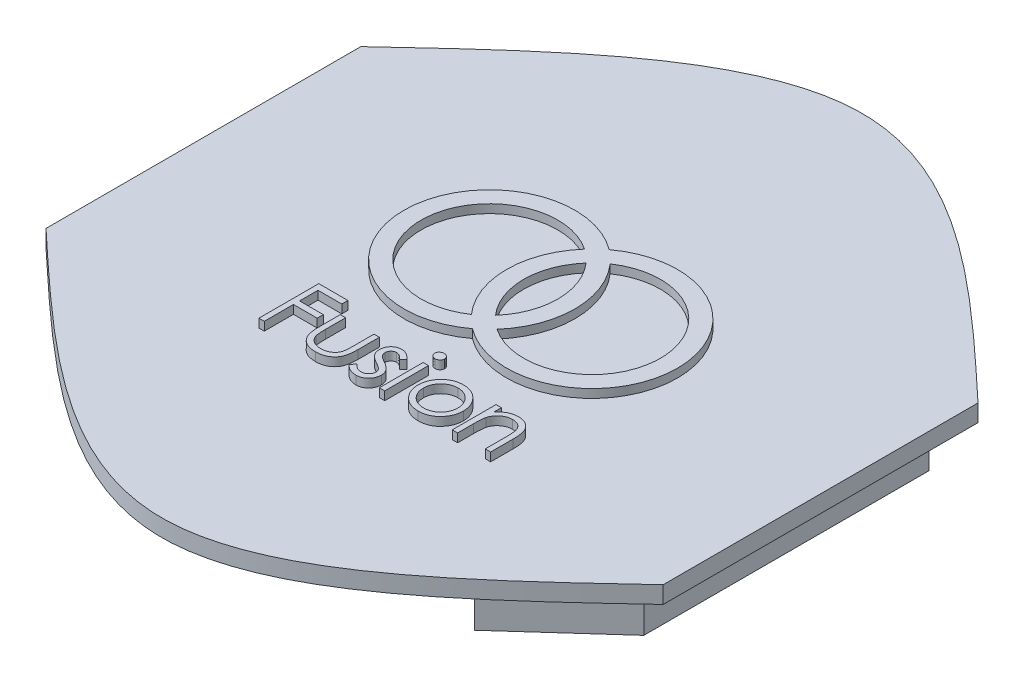
from build123d import *

# Parameters (mm, degrees)
BOSS_EXTRUDE1_DEPTH = 1
BOSS_EXTRUDE2_DEPTH = 3
BOSS_EXTRUDE3_DEPTH = 0.5
SKETCH6_W           = 0.314102564
SKETCH6_H           = 2.557692308
BOSS_EXTRUDE4_DEPTH = 0.5


with BuildPart() as part:
    # Sketch1 → Boss-Extrude1 (new body)
    with BuildSketch(Plane(origin=(0, 0, 0), x_dir=(1, 0, 0), z_dir=(0, 1, 0))):
        with BuildLine():
            Line((0, 41.863275017), (0, 60.273275017))
            add(Edge.make_bspline(
                [(-36.089994589, 60.273275017), (-30.074992276, 65.911788101), (-18.044987203, 77.188479216), (-6.014995884, 65.911788385), (0, 60.273275017)],
                knots=[0, 0, 0, 0, 0.499999981, 1, 1, 1, 1], degree=3))
            Line((-36.089994589, 60.273275017), (-36.089994589, 41.863275017))
            add(Edge.make_bspline(
                [(-36.089994589, 41.863275017), (-30.074992276, 36.224761933), (-18.044987203, 24.948070818), (-6.014995884, 36.22476165), (0, 41.863275017)],
                knots=[0, 0, 0, 0, 0.499999981, 1, 1, 1, 1], degree=3))
        make_face()
    extrude(amount=BOSS_EXTRUDE1_DEPTH)

    # Sketch3 → Boss-Extrude2 (add)
    with BuildSketch(Plane.XZ):
        Polygon((-28.881902587, -64.094380048), (-34.089994589, -59.406509446), (-34.089994589, -42.730040589), (-28.881860862, -38.042159643), (-27.59860355, -39.5761905), (-32.210609347, -43.414080875), (-32.210609347, -58.722469159), (-27.5986156, -62.560374014), align=None)
        Polygon((-7.208092002, -64.094380048), (-8.491378989, -62.560374014), (-3.879385242, -58.722469159), (-3.879385242, -43.414080875), (-8.491391038, -39.5761905), (-7.208133727, -38.042159643), (-2, -42.730040589), (-2, -59.406509446), align=None)
    extrude(amount=BOSS_EXTRUDE2_DEPTH)

    # Sketch5 → Boss-Extrude3 (add)
    with BuildSketch(Plane(origin=(0, 1, 0), x_dir=(1, 0, 0), z_dir=(0, 1, 0))):
        with BuildLine():
            ThreePointArc((-18.044997294, 56.751086287), (-26.044997294, 52.751086287), (-18.044997294, 48.751086287))
            ThreePointArc((-18.044997294, 48.751086287), (-10.044997294, 52.751086287), (-18.044997294, 56.751086287))
        make_face()
        with BuildLine():
            ThreePointArc((-18.044997294, 55.396837598), (-17.044997294, 52.751086287), (-18.044997294, 50.105334976))
            ThreePointArc((-18.044997294, 50.105334976), (-19.044997294, 52.751086287), (-18.044997294, 55.396837598))
        make_face(mode=Mode.SUBTRACT)
        with BuildLine():
            ThreePointArc((-17.294997294, 56.058275426), (-11.044997294, 52.751086287), (-17.294997294, 49.443897149))
            ThreePointArc((-17.294997294, 49.443897149), (-16.044997294, 52.751086287), (-17.294997294, 56.058275426))
        make_face(mode=Mode.SUBTRACT)
        with BuildLine():
            ThreePointArc((-18.794997294, 56.058275426), (-20.044997294, 52.751086287), (-18.794997294, 49.443897149))
            ThreePointArc((-18.794997294, 49.443897149), (-25.044997294, 52.751086287), (-18.794997294, 56.058275426))
        make_face(mode=Mode.SUBTRACT)
    extrude(amount=BOSS_EXTRUDE3_DEPTH)

    # Sketch6 → Boss-Extrude4 (add)
    # profile 1 of 7: a face of its own
    with BuildSketch(Plane(origin=(0, 1, 0), x_dir=(1, 0, 0), z_dir=(0, 1, 0))):
        Polygon((-24.817053319, 46.540134371), (-23.111925113, 46.540134371), (-23.111925113, 46.181160012), (-24.502950754, 46.181160012), (-24.502950754, 45.104236935), (-23.111925113, 45.104236935), (-23.111925113, 44.745262576), (-24.502950754, 44.745262576), (-24.502950754, 43.040134371), (-24.817053319, 43.040134371), align=None)
    # profile 2 of 7: a face of its own
    with BuildSketch(Plane(origin=(0, 1, 0), x_dir=(1, 0, 0), z_dir=(0, 1, 0))):
        with BuildLine():
            Line((-22.61833537, 45.597826679), (-22.304232806, 45.597826679))
            Line((-22.304232806, 45.597826679), (-22.304232806, 44.411528602))
            add(Edge.make_bspline(
                [(-22.304232806, 44.411528602), (-22.304090901, 44.376705853), (-22.303819443, 44.310091565), (-22.301978502, 44.214236378), (-22.297648409, 44.126819665), (-22.292234584, 44.047790928), (-22.285272448, 43.977163537), (-22.276989088, 43.91518418), (-22.267730666, 43.861149996), (-22.258667952, 43.82860664), (-22.254453158, 43.813471711)],
                knots=[0, 0, 0, 0, 1.388932606, 2.656963016, 3.823490214, 4.879454478, 5.816252168, 6.653371382, 7.373723809, 8, 8, 8, 8], degree=3))
            add(Edge.make_bspline(
                [(-22.254453158, 43.813471711), (-22.247691703, 43.79444884), (-22.234309362, 43.756798579), (-22.210035878, 43.702409574), (-22.180007542, 43.652034291), (-22.147147714, 43.603730218), (-22.109248306, 43.558928232), (-22.066788835, 43.517703988), (-22.021190598, 43.478499897), (-21.953435575, 43.432115105), (-21.860776309, 43.382399775), (-21.739123554, 43.339503956), (-21.607219328, 43.313868136), (-21.516054608, 43.310893881), (-21.469196748, 43.30936514)],
                knots=[0, 0, 0, 0, 0.725840625, 1.436591201, 2.137033971, 2.831655856, 3.53531722, 4.242432219, 4.957935707, 5.694543706, 7.190802206, 8.724350549, 10.316345118, 12, 12, 12, 12], degree=3))
            add(Edge.make_bspline(
                [(-21.469196748, 43.30936514), (-21.42234324, 43.310926389), (-21.331690372, 43.313947116), (-21.201235403, 43.338730655), (-21.081983988, 43.380136344), (-20.975133037, 43.437943755), (-20.881167197, 43.508685818), (-20.802862778, 43.591694627), (-20.738255523, 43.684344014), (-20.710046103, 43.753468293), (-20.695859408, 43.788231326)],
                knots=[0, 0, 0, 0, 1.157059328, 2.238695713, 3.266970494, 4.264342957, 5.228770407, 6.160125903, 7.074715775, 8, 8, 8, 8], degree=3))
            add(Edge.make_bspline(
                [(-20.695859408, 43.788231326), (-20.691665178, 43.802197625), (-20.68239276, 43.8330737), (-20.672430408, 43.885453449), (-20.663455947, 43.947918053), (-20.655792771, 44.020876262), (-20.650327608, 44.104137414), (-20.647381581, 44.19767549), (-20.644053306, 44.301196851), (-20.64400279, 44.37366461), (-20.643976395, 44.411528602)],
                knots=[0, 0, 0, 0, 0.557542046, 1.232589297, 2.036731608, 2.971723315, 4.038036528, 5.22795436, 6.551621927, 8, 8, 8, 8], degree=3))
            Line((-20.643976395, 44.411528602), (-20.643976395, 45.597826679))
            Line((-20.643976395, 45.597826679), (-20.329873831, 45.597826679))
            Line((-20.329873831, 45.597826679), (-20.329873831, 44.352634371))
            add(Edge.make_bspline(
                [(-20.329873831, 44.352634371), (-20.330315526, 44.3103272), (-20.331172475, 44.2282455), (-20.336679818, 44.108961388), (-20.346129431, 43.997799143), (-20.360472116, 43.894699923), (-20.37733779, 43.799742442), (-20.399094063, 43.712804996), (-20.425072301, 43.634155442), (-20.454377816, 43.562413665), (-20.488999683, 43.497366771), (-20.525826704, 43.435630954), (-20.568351476, 43.378738019), (-20.61312171, 43.323855882), (-20.662923366, 43.273714354), (-20.716823225, 43.227162878), (-20.774062645, 43.183489847), (-20.835911843, 43.144398567), (-20.901467906, 43.109181922), (-20.970811763, 43.077965844), (-21.044792761, 43.053263267), (-21.122456398, 43.031952601), (-21.204183177, 43.015238132), (-21.28989431, 43.003451565), (-21.379560927, 42.996226234), (-21.440670386, 42.995589189), (-21.472001235, 42.995262576)],
                knots=[0, 0, 0, 0, 1.493040784, 2.896703357, 4.213163133, 5.428574705, 6.569057535, 7.615249723, 8.588095153, 9.490268104, 10.346124644, 11.18633936, 12.024365274, 12.850166724, 13.684164916, 14.514361689, 15.362232829, 16.222528818, 17.093394965, 17.986930858, 18.902426812, 19.842810585, 20.827885679, 21.843828298, 22.894529745, 24, 24, 24, 24], degree=3))
            add(Edge.make_bspline(
                [(-21.472001235, 42.995262576), (-21.503097749, 42.995602283), (-21.564205294, 42.99626984), (-21.653876539, 43.003411647), (-21.739825145, 43.015219818), (-21.821745543, 43.032075035), (-21.899719941, 43.053114105), (-21.974064181, 43.078117641), (-22.043907744, 43.109198122), (-22.110089748, 43.14417568), (-22.172092136, 43.183740955), (-22.230200714, 43.227108995), (-22.284337566, 43.274215058), (-22.334514634, 43.324862415), (-22.380027611, 43.379679351), (-22.421443653, 43.438224912), (-22.459400358, 43.499919), (-22.493753148, 43.565982163), (-22.523264904, 43.638554173), (-22.54932015, 43.71885127), (-22.570630788, 43.807753787), (-22.587973256, 43.905185715), (-22.601924697, 44.010680757), (-22.611610839, 44.124849172), (-22.61702667, 44.247412864), (-22.617889731, 44.332062754), (-22.61833537, 44.37577139)],
                knots=[0, 0, 0, 0, 1.083640291, 2.129454052, 3.13281866, 4.105697902, 5.042300162, 5.946461698, 6.836384745, 7.703652036, 8.553297018, 9.397182691, 10.228592656, 11.052265423, 11.879314572, 12.708807002, 13.549817954, 14.402308542, 15.300838682, 16.27712199, 17.341985831, 18.484375296, 19.725102775, 21.0496083, 22.476576903, 24, 24, 24, 24], degree=3))
            Line((-22.61833537, 44.37577139), (-22.61833537, 45.597826679))
        make_face()
    # profile 3 of 7: a face of its own
    with BuildSketch(Plane(origin=(0, 1, 0), x_dir=(1, 0, 0), z_dir=(0, 1, 0))):
        with BuildLine():
            Line((-18.400386652, 45.278816262), (-18.613527677, 45.05936514))
            add(Edge.make_bspline(
                [(-18.613527677, 45.05936514), (-18.631918181, 45.080678287), (-18.667372907, 45.121767524), (-18.723604388, 45.17670459), (-18.779627991, 45.222841529), (-18.834676805, 45.261793788), (-18.890135074, 45.291242935), (-18.945351992, 45.312737797), (-19.000384731, 45.326039602), (-19.037170766, 45.327754041), (-19.055234408, 45.32859591)],
                knots=[0, 0, 0, 0, 1.26578478, 2.440284043, 3.530471711, 4.527705817, 5.468200915, 6.346673037, 7.188140097, 8, 8, 8, 8], degree=3))
            add(Edge.make_bspline(
                [(-19.055234408, 45.32859591), (-19.077373798, 45.327521037), (-19.120940984, 45.325405839), (-19.183366802, 45.304292408), (-19.241317427, 45.27188367), (-19.291474407, 45.225915086), (-19.333962087, 45.173150817), (-19.364975768, 45.114154493), (-19.383941752, 45.050706449), (-19.386346484, 45.006676591), (-19.387566139, 44.984345108)],
                knots=[0, 0, 0, 0, 0.99966794, 1.967205029, 2.953328237, 3.988086729, 5.028030931, 6.008226631, 6.989793394, 8, 8, 8, 8], degree=3))
            add(Edge.make_bspline(
                [(-19.387566139, 44.984345108), (-19.386455327, 44.964133064), (-19.384236834, 44.923765953), (-19.366990154, 44.864217919), (-19.339524082, 44.806160881), (-19.313853888, 44.770597975), (-19.300627036, 44.752273794)],
                knots=[0, 0, 0, 0, 0.960159726, 1.917612774, 2.927026955, 4, 4, 4, 4], degree=3))
            add(Edge.make_bspline(
                [(-19.300627036, 44.752273794), (-19.292663543, 44.74248921), (-19.27571425, 44.721663955), (-19.243905735, 44.692760102), (-19.207883232, 44.660817851), (-19.164563294, 44.628881014), (-19.115812266, 44.595249289), (-19.060572982, 44.561247156), (-19.000598477, 44.524282731), (-18.957661171, 44.500838295), (-18.935342581, 44.488651999)],
                knots=[0, 0, 0, 0, 0.66740084, 1.420478572, 2.27185888, 3.217733974, 4.268547843, 5.408967954, 6.65319498, 8, 8, 8, 8], degree=3))
            add(Edge.make_bspline(
                [(-18.935342581, 44.488651999), (-18.908129004, 44.473407096), (-18.855561334, 44.443958964), (-18.780868567, 44.398249261), (-18.713081526, 44.352817836), (-18.651625858, 44.308150562), (-18.597684049, 44.262997695), (-18.549619497, 44.219089938), (-18.508631053, 44.17510063), (-18.485677126, 44.144367516), (-18.474705562, 44.12967764)],
                knots=[0, 0, 0, 0, 1.27191281, 2.456916733, 3.569705269, 4.599008579, 5.553216877, 6.436649441, 7.252746552, 8, 8, 8, 8], degree=3))
            add(Edge.make_bspline(
                [(-18.474705562, 44.12967764), (-18.456495035, 44.100011552), (-18.420252705, 44.040970531), (-18.382194439, 43.943752104), (-18.360134164, 43.840641601), (-18.357071944, 43.770109381), (-18.355514857, 43.734244948)],
                knots=[0, 0, 0, 0, 0.995354457, 1.980940102, 2.973342415, 4, 4, 4, 4], degree=3))
            add(Edge.make_bspline(
                [(-18.355514857, 43.734244948), (-18.356234391, 43.708975802), (-18.357652311, 43.659180189), (-18.367510378, 43.585845359), (-18.384465354, 43.515710801), (-18.407559108, 43.448015517), (-18.438743481, 43.384056577), (-18.475291278, 43.322220328), (-18.51916619, 43.263844397), (-18.569257565, 43.209005437), (-18.624103059, 43.15891969), (-18.682609198, 43.114895736), (-18.744848028, 43.078321399), (-18.81037483, 43.048056053), (-18.879338484, 43.023987795), (-18.951749773, 43.007325264), (-19.027378528, 42.997352503), (-19.078808336, 42.995968027), (-19.105014056, 42.995262576)],
                knots=[0, 0, 0, 0, 1.032770009, 2.035186124, 3.017557409, 3.978232242, 4.952395191, 5.920591857, 6.910227898, 7.931268572, 8.952309245, 9.941945286, 10.918353717, 11.897095711, 12.887975737, 13.898235213, 14.929059601, 16, 16, 16, 16], degree=3))
            add(Edge.make_bspline(
                [(-19.105014056, 42.995262576), (-19.140381231, 42.996255277), (-19.210624158, 42.998226884), (-19.314513877, 43.016732945), (-19.416034636, 43.045528339), (-19.514418176, 43.085244273), (-19.60746429, 43.135394986), (-19.692595215, 43.195457379), (-19.770106677, 43.263447377), (-19.814224951, 43.315560288), (-19.836284088, 43.341616743)],
                knots=[0, 0, 0, 0, 1.013940152, 2.01379169, 3.017749504, 4.037548394, 5.051665909, 6.043208538, 7.021604269, 8, 8, 8, 8], degree=3))
            Line((-19.836284088, 43.341616743), (-19.628050915, 43.57859591))
            add(Edge.make_bspline(
                [(-19.628050915, 43.57859591), (-19.608278502, 43.557241145), (-19.569946689, 43.515841705), (-19.508645473, 43.460717364), (-19.446266072, 43.414516093), (-19.383431385, 43.375872678), (-19.319211291, 43.346097275), (-19.253965676, 43.325178681), (-19.187827252, 43.311734489), (-19.143405117, 43.310156207), (-19.121139857, 43.30936514)],
                knots=[0, 0, 0, 0, 1.179806542, 2.287233372, 3.337373186, 4.324005949, 5.273901747, 6.200048787, 7.097828587, 8, 8, 8, 8], degree=3))
            add(Edge.make_bspline(
                [(-19.121139857, 43.30936514), (-19.090821931, 43.310735965), (-19.031585789, 43.313414327), (-18.946742031, 43.337731419), (-18.868403404, 43.375861371), (-18.800380059, 43.429946069), (-18.742477898, 43.492901642), (-18.700549723, 43.563815761), (-18.674273548, 43.640607218), (-18.671187549, 43.69383952), (-18.669617421, 43.720923634)],
                knots=[0, 0, 0, 0, 1.072336372, 2.095165389, 3.102688358, 4.141489647, 5.156069229, 6.117746104, 7.042326257, 8, 8, 8, 8], degree=3))
            add(Edge.make_bspline(
                [(-18.669617421, 43.720923634), (-18.670703715, 43.743233253), (-18.672848458, 43.787280608), (-18.68969173, 43.851030949), (-18.716304582, 43.91150023), (-18.742509231, 43.946889877), (-18.755855402, 43.964914019)],
                knots=[0, 0, 0, 0, 1.013901739, 2.00181326, 2.98231254, 4, 4, 4, 4], degree=3))
            add(Edge.make_bspline(
                [(-18.755855402, 43.964914019), (-18.763877796, 43.973949381), (-18.781353469, 43.993631663), (-18.81340871, 44.022056742), (-18.851790572, 44.052694841), (-18.896930735, 44.08502643), (-18.948920197, 44.118625035), (-19.007969672, 44.153314387), (-19.073270225, 44.190742113), (-19.119440856, 44.215561768), (-19.143575754, 44.228535813)],
                knots=[0, 0, 0, 0, 0.615000592, 1.339693406, 2.178160186, 3.116406724, 4.166410947, 5.330106347, 6.604359322, 8, 8, 8, 8], degree=3))
            add(Edge.make_bspline(
                [(-19.143575754, 44.228535813), (-19.169622394, 44.243074945), (-19.220135142, 44.271270961), (-19.291682433, 44.315187042), (-19.356229787, 44.359854316), (-19.415330362, 44.402767156), (-19.467491367, 44.446188099), (-19.512507316, 44.490165351), (-19.552150531, 44.532925337), (-19.574097943, 44.563222634), (-19.584581363, 44.577694467)],
                knots=[0, 0, 0, 0, 1.262093308, 2.447601706, 3.550203992, 4.582594899, 5.537233252, 6.418365656, 7.244515135, 8, 8, 8, 8], degree=3))
            add(Edge.make_bspline(
                [(-19.584581363, 44.577694467), (-19.602711963, 44.606840082), (-19.638979498, 44.665141498), (-19.674194689, 44.762451974), (-19.698400718, 44.864897032), (-19.700563108, 44.935583886), (-19.701668703, 44.971724916)],
                knots=[0, 0, 0, 0, 0.985009483, 1.970363186, 2.962279964, 4, 4, 4, 4], degree=3))
            add(Edge.make_bspline(
                [(-19.701668703, 44.971724916), (-19.701134508, 44.995350314), (-19.700089012, 45.041588565), (-19.69174496, 45.109527385), (-19.676553249, 45.174075539), (-19.657498326, 45.236202402), (-19.631015322, 45.294704496), (-19.599369417, 45.350361967), (-19.562181992, 45.403097885), (-19.519338701, 45.452101017), (-19.472232056, 45.496610343), (-19.421337286, 45.535408971), (-19.36779903, 45.568515326), (-19.31139061, 45.596280487), (-19.251570137, 45.617281869), (-19.188755751, 45.631739255), (-19.123074596, 45.641394457), (-19.07817347, 45.642257542), (-19.055234408, 45.642698474)],
                knots=[0, 0, 0, 0, 1.087655834, 2.128696564, 3.144119009, 4.137814668, 5.115653402, 6.093965665, 7.082169637, 8.081268856, 9.086088321, 10.061021666, 11.022561449, 11.980240094, 12.950172527, 13.934149372, 14.944599409, 16, 16, 16, 16], degree=3))
            add(Edge.make_bspline(
                [(-19.055234408, 45.642698474), (-19.028042345, 45.641594133), (-18.973148123, 45.639364735), (-18.890793497, 45.621659045), (-18.808560155, 45.592525941), (-18.726236805, 45.552289707), (-18.644426515, 45.500222831), (-18.562409659, 45.437293532), (-18.479201629, 45.363915817), (-18.427245315, 45.307816592), (-18.400386652, 45.278816262)],
                knots=[0, 0, 0, 0, 0.845714091, 1.707292901, 2.609013841, 3.555613372, 4.552488639, 5.621697636, 6.770543573, 8, 8, 8, 8], degree=3))
        make_face()
    # profile 4 of 7: a face of its own
    with BuildSketch(Plane(origin=(0, 1, 0), x_dir=(1, 0, 0), z_dir=(0, 1, 0))):
        with BuildLine():
            add(Edge.make_bspline(
                [(-17.616532485, 46.674749756), (-17.597041169, 46.673845603), (-17.55887343, 46.672075099), (-17.503680162, 46.656913622), (-17.45342315, 46.631213937), (-17.408845417, 46.596734256), (-17.37059353, 46.556184812), (-17.34381282, 46.508923844), (-17.326600424, 46.457865205), (-17.324521868, 46.422250116), (-17.323463575, 46.404116743)],
                knots=[0, 0, 0, 0, 1.055194115, 2.066272739, 3.074728998, 4.095836921, 5.109056067, 6.073838105, 7.019297344, 8, 8, 8, 8], degree=3))
            add(Edge.make_bspline(
                [(-17.323463575, 46.404116743), (-17.324545735, 46.38645409), (-17.326685037, 46.351537115), (-17.343799525, 46.301363643), (-17.370821763, 46.254759359), (-17.408820888, 46.214288649), (-17.453429649, 46.179828029), (-17.503678435, 46.15412329), (-17.558873884, 46.138963153), (-17.597041323, 46.137192464), (-17.616532485, 46.136288217)],
                knots=[0, 0, 0, 0, 0.96129708, 1.900370562, 2.859976407, 3.87933698, 4.906634145, 5.921202961, 6.938410037, 8, 8, 8, 8], degree=3))
            add(Edge.make_bspline(
                [(-17.616532485, 46.136288217), (-17.63580076, 46.137157937), (-17.67330394, 46.138850734), (-17.727670783, 46.154420752), (-17.777499272, 46.179836825), (-17.822163945, 46.21406301), (-17.859394138, 46.255007907), (-17.886492463, 46.301335201), (-17.903567425, 46.351544356), (-17.905712054, 46.386456522), (-17.906796908, 46.404116743)],
                knots=[0, 0, 0, 0, 1.054934014, 2.053291228, 3.073705704, 4.106921865, 5.123545215, 6.088680038, 7.033164197, 8, 8, 8, 8], degree=3))
            add(Edge.make_bspline(
                [(-17.906796908, 46.404116743), (-17.905735822, 46.422247592), (-17.903651781, 46.457857725), (-17.886479664, 46.508952758), (-17.859619857, 46.55593426), (-17.822139293, 46.596959759), (-17.777505833, 46.631205194), (-17.727669088, 46.656616175), (-17.673304388, 46.672187515), (-17.635800912, 46.673880129), (-17.616532485, 46.674749756)],
                knots=[0, 0, 0, 0, 0.98631895, 1.937192651, 2.907499808, 3.917963147, 4.944918757, 5.95915025, 6.951458133, 8, 8, 8, 8], degree=3))
        make_face()
    # profile 5 of 7: a face of its own
    with BuildSketch(Plane(origin=(0, 1, 0), x_dir=(1, 0, 0), z_dir=(0, 1, 0))):
        with Locations((-17.615130242, 44.318980525)):
            Rectangle(SKETCH6_W, SKETCH6_H)
    # profile 6 of 7: a face of its own
    with BuildSketch(Plane(origin=(0, 1, 0), x_dir=(1, 0, 0), z_dir=(0, 1, 0))):
        with BuildLine():
            add(Edge.make_bspline(
                [(-15.459881844, 45.642698474), (-15.411890571, 45.641676582), (-15.317791414, 45.639672904), (-15.179983528, 45.618257938), (-15.048438392, 45.585510574), (-14.9226522, 45.540239012), (-14.804235904, 45.479557061), (-14.69146466, 45.40714777), (-14.584647651, 45.321365176), (-14.520624622, 45.255007108), (-14.488127036, 45.221324275)],
                knots=[0, 0, 0, 0, 1.054011418, 2.066658804, 3.057071809, 4.030435133, 4.997543892, 5.974964718, 6.972108034, 8, 8, 8, 8], degree=3))
            add(Edge.make_bspline(
                [(-14.488127036, 45.221324275), (-14.460145082, 45.189110289), (-14.404722702, 45.125305747), (-14.333656983, 45.021850134), (-14.272435423, 44.914710033), (-14.223372462, 44.802462707), (-14.184687439, 44.686088036), (-14.157221742, 44.565186024), (-14.140884807, 44.440023677), (-14.13868184, 44.355019839), (-14.137566139, 44.311969307)],
                knots=[0, 0, 0, 0, 1.025258237, 2.030674902, 3.01204498, 3.988269485, 4.97094183, 5.956517959, 6.965070386, 8, 8, 8, 8], degree=3))
            add(Edge.make_bspline(
                [(-14.137566139, 44.311969307), (-14.138547476, 44.268669249), (-14.140486645, 44.183106316), (-14.158830261, 44.05708695), (-14.187361347, 43.934892127), (-14.228193185, 43.817033434), (-14.280551294, 43.703150606), (-14.344441982, 43.593741057), (-14.420313599, 43.488588924), (-14.506317596, 43.388587086), (-14.601369472, 43.296420871), (-14.70448562, 43.216092601), (-14.813639654, 43.147271077), (-14.930283007, 43.091834661), (-15.053350494, 43.048124961), (-15.183107562, 43.017424944), (-15.319352633, 42.998863261), (-15.412379854, 42.996479687), (-15.459881844, 42.995262576)],
                knots=[0, 0, 0, 0, 0.998656419, 1.973391657, 2.932242238, 3.890759089, 4.846373663, 5.82037756, 6.809684879, 7.83454468, 8.860553229, 9.859544525, 10.845671541, 11.83227036, 12.833544569, 13.85385346, 14.904124723, 16, 16, 16, 16], degree=3))
            add(Edge.make_bspline(
                [(-15.459881844, 42.995262576), (-15.507616564, 42.996483772), (-15.601107423, 42.998875547), (-15.737833405, 43.01735283), (-15.867823024, 43.048110812), (-15.991051623, 43.091978305), (-16.10819647, 43.147272849), (-16.217982967, 43.215884538), (-16.321182882, 43.296444693), (-16.416254867, 43.388580631), (-16.502253472, 43.488590587), (-16.57812648, 43.593740625), (-16.642016806, 43.703150719), (-16.69437501, 43.817033404), (-16.735206823, 43.934892136), (-16.763737916, 44.057086948), (-16.78208153, 44.183106317), (-16.784020699, 44.268669249), (-16.785002036, 44.311969307)],
                knots=[0, 0, 0, 0, 1.099876186, 2.154163076, 3.173186993, 4.173200201, 5.163417411, 6.152872554, 7.150605724, 8.17532212, 9.198891216, 10.186952605, 11.159729845, 12.11414092, 13.071450619, 14.029093627, 15.002601286, 16, 16, 16, 16], degree=3))
            add(Edge.make_bspline(
                [(-16.785002036, 44.311969307), (-16.783878726, 44.354785853), (-16.781654765, 44.439555255), (-16.765334256, 44.564482316), (-16.737975699, 44.685179705), (-16.699244303, 44.801105181), (-16.649729112, 44.912860617), (-16.589367824, 45.020265448), (-16.517577191, 45.123253248), (-16.46237524, 45.186975329), (-16.434441139, 45.21922091)],
                knots=[0, 0, 0, 0, 1.031353054, 2.041901799, 3.029428768, 4.008703097, 4.981709435, 5.96992636, 6.972712378, 8, 8, 8, 8], degree=3))
            add(Edge.make_bspline(
                [(-16.434441139, 45.21922091), (-16.401992548, 45.253195849), (-16.338176684, 45.320013545), (-16.230827956, 45.405546069), (-16.118334135, 45.479462143), (-15.998609209, 45.538938358), (-15.872926351, 45.585776876), (-15.740707109, 45.618342391), (-15.602431593, 45.639595746), (-15.507871972, 45.641653924), (-15.459881844, 45.642698474)],
                knots=[0, 0, 0, 0, 1.027980169, 2.021703884, 2.998553061, 3.971491411, 4.943284454, 5.930300938, 6.949603206, 8, 8, 8, 8], degree=3))
        make_face()
        with BuildLine():
            add(Edge.make_bspline(
                [(-15.461284088, 45.32859591), (-15.495221699, 45.327631318), (-15.562220828, 45.325727035), (-15.660840412, 45.311243131), (-15.755780566, 45.288295627), (-15.84722141, 45.25569157), (-15.934854583, 45.213592671), (-16.018763985, 45.161884311), (-16.099196425, 45.101251355), (-16.174578489, 45.031788683), (-16.243760801, 44.955909689), (-16.304238777, 44.87506133), (-16.355663884, 44.790554983), (-16.398504043, 44.702302772), (-16.430411231, 44.609410358), (-16.453584253, 44.512929727), (-16.468054494, 44.412664311), (-16.469940872, 44.344503292), (-16.470899472, 44.309865942)],
                knots=[0, 0, 0, 0, 1.021534396, 2.016698045, 2.994645724, 3.958388632, 4.93408049, 5.916473867, 6.921342795, 7.962252576, 8.998418191, 10.008913653, 10.997312074, 11.973003931, 12.956656626, 13.948281152, 14.957379055, 16, 16, 16, 16], degree=3))
            add(Edge.make_bspline(
                [(-16.470899472, 44.309865942), (-16.469292649, 44.265113914), (-16.466103404, 44.176289509), (-16.440168168, 44.045478386), (-16.396781888, 43.919896534), (-16.338194608, 43.800280148), (-16.26478839, 43.68960787), (-16.178301323, 43.590936386), (-16.079661623, 43.505750574), (-15.970045122, 43.435069729), (-15.851690804, 43.378909973), (-15.726434483, 43.339110997), (-15.595793789, 43.313239305), (-15.506513058, 43.310667831), (-15.461284088, 43.30936514)],
                knots=[0, 0, 0, 0, 1.016792936, 2.018143844, 3.017858371, 4.030088057, 5.03801393, 6.028138512, 7.003788237, 7.991172063, 8.984598303, 9.972568034, 10.972917682, 12, 12, 12, 12], degree=3))
            add(Edge.make_bspline(
                [(-15.461284088, 43.30936514), (-15.416057719, 43.310675421), (-15.326782123, 43.313261877), (-15.196322946, 43.338980697), (-15.071408974, 43.379084358), (-14.953177587, 43.435006568), (-14.843610983, 43.506018982), (-14.744261862, 43.59045536), (-14.658513251, 43.689869211), (-14.585179646, 43.80042674), (-14.525632903, 43.919711092), (-14.482449701, 44.045501564), (-14.456452115, 44.176283606), (-14.453271287, 44.265111937), (-14.451668703, 44.309865942)],
                knots=[0, 0, 0, 0, 1.02726834, 2.027799167, 3.010890988, 4.004497153, 4.992059811, 5.971914811, 6.958719428, 7.966827853, 8.981595046, 9.981490638, 10.983022906, 12, 12, 12, 12], degree=3))
            add(Edge.make_bspline(
                [(-14.451668703, 44.309865942), (-14.452626973, 44.344503499), (-14.454512702, 44.412664925), (-14.468987667, 44.512927379), (-14.492143206, 44.609418975), (-14.524114824, 44.702270978), (-14.566768837, 44.790783483), (-14.61918563, 44.87481321), (-14.679416656, 44.956189756), (-14.749433777, 45.031543397), (-14.824737155, 45.101278433), (-14.905202193, 45.161907823), (-14.988987171, 45.213365418), (-15.076365754, 45.256051659), (-15.167818322, 45.287998999), (-15.262625451, 45.311375631), (-15.360824261, 45.325665827), (-15.427583304, 45.327612969), (-15.461284088, 45.32859591)],
                knots=[0, 0, 0, 0, 1.042956736, 2.052379634, 3.044323526, 4.02829302, 5.004299113, 5.996692471, 7.007513377, 8.048758398, 9.090003419, 10.095195979, 11.07790575, 12.047570684, 13.018257071, 13.989683339, 14.985167495, 16, 16, 16, 16], degree=3))
        make_face(mode=Mode.SUBTRACT)
    # profile 7 of 7: a face of its own
    with BuildSketch(Plane(origin=(0, 1, 0), x_dir=(1, 0, 0), z_dir=(0, 1, 0))):
        with BuildLine():
            Line((-13.509361011, 45.597826679), (-13.195258447, 45.597826679))
            Line((-13.195258447, 45.597826679), (-13.195258447, 45.136488538))
            add(Edge.make_bspline(
                [(-13.195258447, 45.136488538), (-13.161720812, 45.178331261), (-13.096639861, 45.259528524), (-12.988255527, 45.366249099), (-12.873711627, 45.454194324), (-12.753709623, 45.524298118), (-12.628086613, 45.577144744), (-12.497608343, 45.615310675), (-12.361493637, 45.638195503), (-12.2689292, 45.641185734), (-12.222101395, 45.642698474)],
                knots=[0, 0, 0, 0, 1.12780773, 2.188550248, 3.19190651, 4.159438251, 5.104880172, 6.052711206, 7.014878035, 8, 8, 8, 8], degree=3))
            add(Edge.make_bspline(
                [(-12.222101395, 45.642698474), (-12.174770761, 45.640953278), (-12.082133294, 45.63753751), (-11.947255232, 45.610520819), (-11.821281838, 45.564375564), (-11.704662283, 45.501163493), (-11.599535069, 45.42255702), (-11.507210218, 45.330979238), (-11.43084697, 45.225643155), (-11.379649607, 45.127919998), (-11.34592396, 45.041231204), (-11.324691622, 44.966984454), (-11.306660641, 44.884266303), (-11.291028893, 44.793326714), (-11.280451781, 44.693528524), (-11.272109489, 44.585280832), (-11.266130795, 44.468618701), (-11.265893588, 44.387932074), (-11.265771267, 44.346324275)],
                knots=[0, 0, 0, 0, 1.235846778, 2.418850247, 3.575807741, 4.728682307, 5.871620074, 6.994088408, 8.11269785, 9.256955736, 9.865816715, 10.540099792, 11.271859618, 12.076849838, 12.949306005, 13.892391288, 14.913166135, 16, 16, 16, 16], degree=3))
            Line((-11.265771267, 44.346324275), (-11.265771267, 43.040134371))
            Line((-11.265771267, 43.040134371), (-11.579873831, 43.040134371))
            Line((-11.579873831, 43.040134371), (-11.579873831, 44.243259371))
            add(Edge.make_bspline(
                [(-11.579873831, 44.243259371), (-11.580067039, 44.278081816), (-11.580436613, 44.344691227), (-11.58160226, 44.44006025), (-11.584412067, 44.526546828), (-11.58836038, 44.603944196), (-11.59413941, 44.672178032), (-11.600162041, 44.731387309), (-11.607527018, 44.781496852), (-11.614089931, 44.811661934), (-11.617033286, 44.825190461)],
                knots=[0, 0, 0, 0, 1.430800155, 2.736877192, 3.918605307, 4.986035426, 5.920637409, 6.731861385, 7.431261377, 8, 8, 8, 8], degree=3))
            add(Edge.make_bspline(
                [(-11.617033286, 44.825190461), (-11.627658818, 44.864901646), (-11.648109679, 44.94133339), (-11.698643662, 45.045007743), (-11.762457843, 45.133205931), (-11.840355692, 45.205382652), (-11.931584768, 45.261553489), (-12.03589191, 45.300527444), (-12.152270551, 45.324903713), (-12.234124934, 45.327330845), (-12.276788895, 45.32859591)],
                knots=[0, 0, 0, 0, 1.084156227, 2.086665306, 3.027808233, 3.945421172, 4.874247719, 5.839848303, 6.874090471, 8, 8, 8, 8], degree=3))
            add(Edge.make_bspline(
                [(-12.276788895, 45.32859591), (-12.302056579, 45.328119905), (-12.352060672, 45.327177904), (-12.426210644, 45.317726606), (-12.498134817, 45.30226815), (-12.568555026, 45.281399513), (-12.63606282, 45.252737244), (-12.702827111, 45.220207873), (-12.766333875, 45.179659661), (-12.827937272, 45.13446904), (-12.88525008, 45.084389833), (-12.938578418, 45.031545323), (-12.986116439, 44.975269719), (-13.029185114, 44.916469771), (-13.066363377, 44.854337933), (-13.098816465, 44.789473627), (-13.12635216, 44.721791478), (-13.140034853, 44.674816417), (-13.146881043, 44.651312256)],
                knots=[0, 0, 0, 0, 1.023777757, 2.026029729, 3.023749952, 4.003683103, 4.997618607, 5.993177895, 7.010360494, 8.046726602, 9.087585522, 10.09234134, 11.086953743, 12.070360549, 13.043493632, 14.017870808, 15.008233677, 16, 16, 16, 16], degree=3))
            add(Edge.make_bspline(
                [(-13.146881043, 44.651312256), (-13.150820691, 44.634057053), (-13.1593971, 44.596493378), (-13.16866028, 44.534848959), (-13.177067856, 44.463538984), (-13.184104814, 44.382646667), (-13.188410231, 44.291888792), (-13.193104627, 44.191652954), (-13.194813688, 44.081539466), (-13.195106043, 44.004877773), (-13.195258447, 43.964914019)],
                knots=[0, 0, 0, 0, 0.615963638, 1.340920617, 2.168419149, 3.115676021, 4.16674242, 5.331190069, 6.6087489, 8, 8, 8, 8], degree=3))
            Line((-13.195258447, 43.964914019), (-13.195258447, 43.040134371))
            Line((-13.195258447, 43.040134371), (-13.509361011, 43.040134371))
            Line((-13.509361011, 43.040134371), (-13.509361011, 45.597826679))
        make_face()
    extrude(amount=BOSS_EXTRUDE4_DEPTH)


solid = part.part
